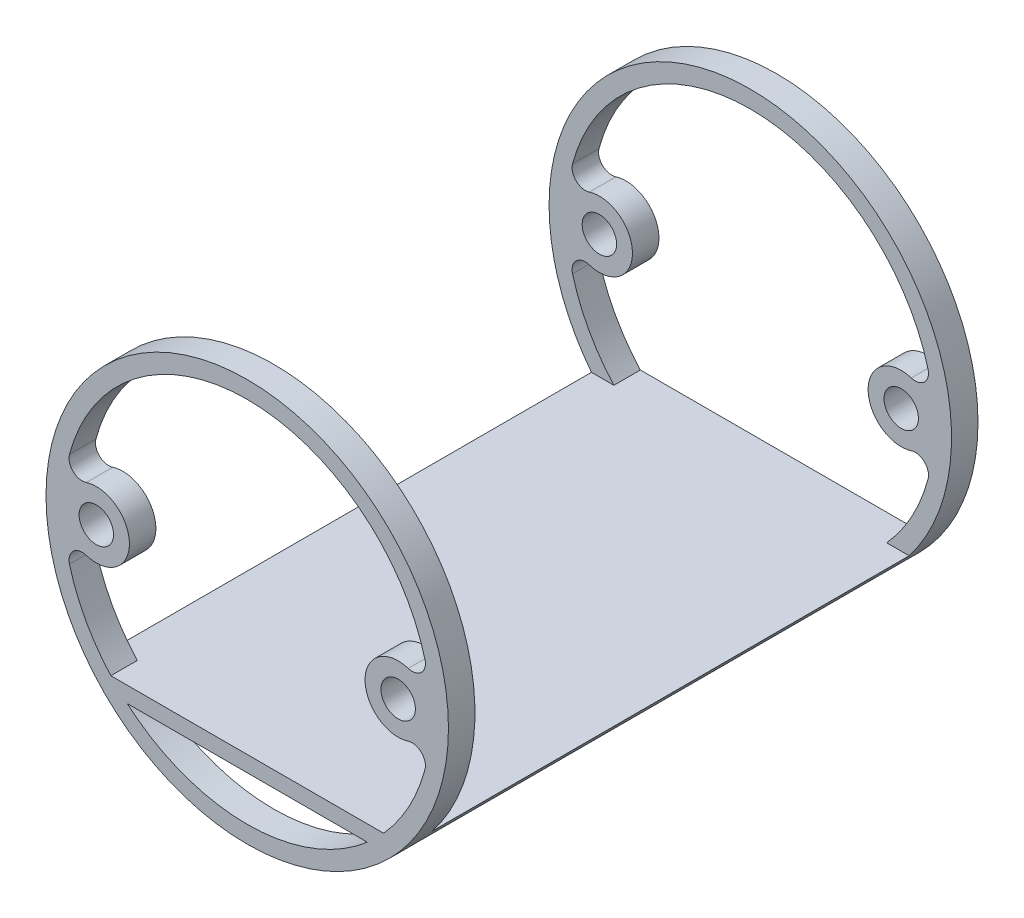
from build123d import *

# Parameters (mm, degrees)
SKETCH1_R           = 38
SKETCH1_R_2         = 3.25
BOSS_EXTRUDE1_DEPTH = 5
BOSS_EXTRUDE2_START = 90
BOSS_EXTRUDE2_DEPTH = 90
BOSS_EXTRUDE3_START = 5
SKETCH3_R           = 3.25
BOSS_EXTRUDE3_DEPTH = 5


with BuildPart() as part:
    # Sketch1 → Boss-Extrude1 (new body)
    with BuildSketch(Plane.XY):
        Circle(SKETCH1_R)
        with Locations((-28.5, 0)):
            Circle(SKETCH1_R_2, mode=Mode.SUBTRACT)
        with Locations((28.5, 0)):
            Circle(SKETCH1_R_2, mode=Mode.SUBTRACT)
        with BuildLine():
            Line((-25.759706908, -23.323807579), (25.759706908, -23.323807579))
            ThreePointArc((25.759706908, -23.323807579), (30.518267855, -16.619200556), (33.568509452, -8.984301485))
            ThreePointArc((33.568509452, -8.984301485), (32.879612131, -6.529477906), (30.395363409, -5.955677757))
            ThreePointArc((30.395363409, -5.955677757), (22.25, 0), (30.395363409, 5.955677757))
            ThreePointArc((30.395363409, 5.955677757), (32.879612131, 6.529477906), (33.568509452, 8.984301485))
            ThreePointArc((33.568509452, 8.984301485), (0, 34.75), (-33.568509452, 8.984301485))
            ThreePointArc((-33.568509452, 8.984301485), (-32.879612131, 6.529477906), (-30.395363409, 5.955677757))
            ThreePointArc((-30.395363409, 5.955677757), (-22.25, 0), (-30.395363409, -5.955677757))
            ThreePointArc((-30.395363409, -5.955677757), (-32.879612131, -6.529477906), (-33.568509452, -8.984301485))
            ThreePointArc((-33.568509452, -8.984301485), (-30.518267855, -16.619200556), (-25.759706908, -23.323807579))
        make_face(mode=Mode.SUBTRACT)
        with BuildLine():
            Line((-22.685229876, -26.323807579), (22.685229876, -26.323807579))
            ThreePointArc((22.685229876, -26.323807579), (0, -34.75), (-22.685229876, -26.323807579))
        make_face(mode=Mode.SUBTRACT)
    extrude(amount=BOSS_EXTRUDE1_DEPTH)

    # Sketch2 → Boss-Extrude2 (add)
    with BuildSketch(Plane(origin=(0, 0, 0), x_dir=(-1, 0, 0), z_dir=(0, 0, -1)).offset(BOSS_EXTRUDE2_START)):
        with BuildLine():
            Line((-30, -23.323807579), (30, -23.323807579))
            ThreePointArc((30, -23.323807579), (28.741879175, -24.857682545), (27.405421991, -26.323807579))
            Line((27.405421991, -26.323807579), (-27.405421991, -26.323807579))
            ThreePointArc((-27.405421991, -26.323807579), (-28.741879175, -24.857682545), (-30, -23.323807579))
        make_face()
    extrude(amount=-BOSS_EXTRUDE2_DEPTH)

    # Sketch3 → Boss-Extrude3 (add)
    with BuildSketch(Plane(origin=(0, 0, -90), x_dir=(-1, 0, 0), z_dir=(0, 0, -1)).offset(BOSS_EXTRUDE3_START)):
        with BuildLine():
            ThreePointArc((-30, -23.323807579), (-28.741879175, -24.857682545), (-27.405421991, -26.323807579))
            ThreePointArc((-27.405421991, -26.323807579), (0, -38), (27.405421991, -26.323807579))
            ThreePointArc((27.405421991, -26.323807579), (28.741879175, -24.857682545), (30, -23.323807579))
            ThreePointArc((30, -23.323807579), (0, 38), (-30, -23.323807579))
        make_face()
        with Locations(Location((28.5, 0, 0), (0, 0, 180))):
            Circle(SKETCH3_R, mode=Mode.SUBTRACT)
        with Locations(Location((-28.5, 0, 0), (0, 0, 180))):
            Circle(SKETCH3_R, mode=Mode.SUBTRACT)
        with BuildLine():
            Line((-22.685229876, -26.323807579), (22.685229876, -26.323807579))
            ThreePointArc((22.685229876, -26.323807579), (0, -34.75), (-22.685229876, -26.323807579))
        make_face(mode=Mode.SUBTRACT)
        with BuildLine():
            Line((25.759706908, -23.323807579), (-25.759706908, -23.323807579))
            ThreePointArc((-25.759706908, -23.323807579), (-30.518267855, -16.619200556), (-33.568509452, -8.984301485))
            ThreePointArc((-33.568509452, -8.984301485), (-32.879612131, -6.529477906), (-30.395363409, -5.955677757))
            ThreePointArc((-30.395363409, -5.955677757), (-22.25, 0), (-30.395363409, 5.955677757))
            ThreePointArc((-30.395363409, 5.955677757), (-32.879612131, 6.529477906), (-33.568509452, 8.984301485))
            ThreePointArc((-33.568509452, 8.984301485), (0, 34.75), (33.568509452, 8.984301485))
            ThreePointArc((33.568509452, 8.984301485), (32.879612131, 6.529477906), (30.395363409, 5.955677757))
            ThreePointArc((30.395363409, 5.955677757), (22.25, 0), (30.395363409, -5.955677757))
            ThreePointArc((30.395363409, -5.955677757), (32.879612131, -6.529477906), (33.568509452, -8.984301485))
            ThreePointArc((33.568509452, -8.984301485), (30.518267855, -16.619200556), (25.759706908, -23.323807579))
        make_face(mode=Mode.SUBTRACT)
    extrude(amount=-BOSS_EXTRUDE3_DEPTH)


solid = part.part
